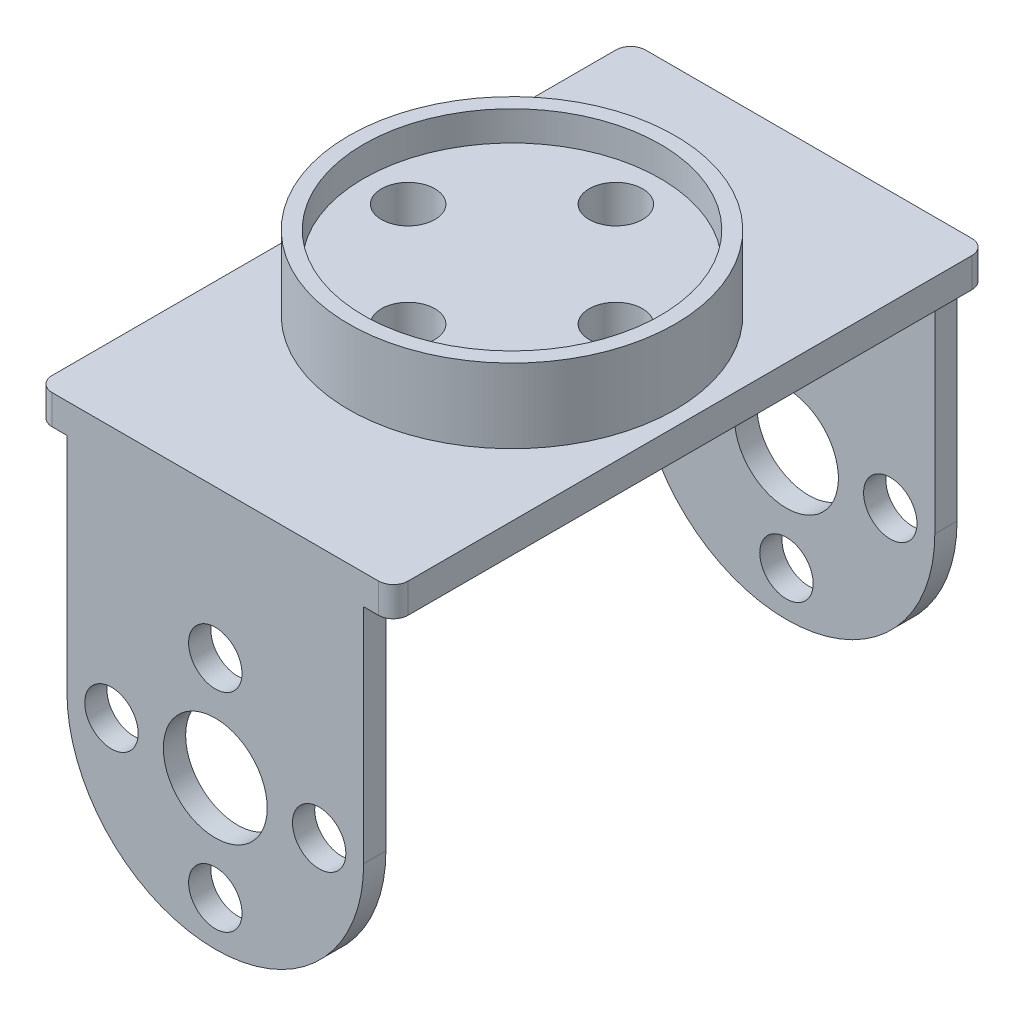
from build123d import *

# Parameters (mm, degrees)
SKETCH_1_W               = 24
SKETCH_1_H               = 30
EXTRUDE_1_DEPTH          = 40
CUT_EXTRUDE_1_DEPTH      = 56.461698495
CUT_EXTRUDE_2_DEPTH      = 18.5
CUT_EXTRUDE_2_DEPTH_BACK = 18.5
CUT_EXTRUDE_3_REACH      = 57.462
SKETCH_4_R               = 1.8
SKETCH_4_R_2             = 3.5
SKETCH_5_R               = 11
EXTRUDE_2_DEPTH          = 5
SKETCH_6_R               = 10
CUT_EXTRUDE_4_DEPTH      = 2
SKETCH_7_R               = 1.8
CUT_EXTRUDE_5_DEPTH      = 56.461698495
SKETCH_8_R               = 2.7
CUT_EXTRUDE_6_DEPTH      = 2
FILLET_1_R               = 1


with BuildPart() as part:
    # 草图1 → 凸台-拉伸1 (new body)
    with BuildSketch(Plane.XY):
        with Locations((-12, 15)):
            Rectangle(SKETCH_1_W, SKETCH_1_H)
    extrude(amount=EXTRUDE_1_DEPTH)

    # 草图2 → 切除-拉伸1 (cut, through all)
    with BuildSketch(Plane(origin=(0, 0, 0), x_dir=(-1, 0, 0), z_dir=(0, 0, -1))):
        with BuildLine():
            Line((0, 0), (12, 0))
            Line((12, 0), (12, 3))
            ThreePointArc((12, 3), (4.928932188, 5.928932188), (2, 13))
            Line((2, 13), (2, 28))
            Line((2, 28), (0, 28))
            Line((0, 28), (0, 0))
        make_face()
        with BuildLine():
            Line((12, 3), (12, 0))
            Line((12, 0), (24, 0))
            Line((24, 0), (24, 28))
            Line((24, 28), (22, 28))
            Line((22, 28), (22, 13))
            ThreePointArc((22, 13), (19.071067812, 5.928932188), (12, 3))
        make_face()
    extrude(amount=-CUT_EXTRUDE_1_DEPTH, mode=Mode.SUBTRACT)

    # 草图3 → 切除-拉伸2 (cut, two sides: drawn at the far end of the back side and taken through both)
    with BuildSketch(Plane(origin=(0, 0, 20), x_dir=(-1, 0, 0), z_dir=(0, 0, -1)).offset(-CUT_EXTRUDE_2_DEPTH_BACK)):
        with BuildLine():
            Line((2, 28), (2, 13))
            ThreePointArc((2, 13), (12, 3), (22, 13))
            Line((22, 13), (22, 28))
            Line((22, 28), (2, 28))
        make_face()
    extrude(amount=CUT_EXTRUDE_2_DEPTH + CUT_EXTRUDE_2_DEPTH_BACK, mode=Mode.SUBTRACT)

    # 切除-拉伸3: up to this face of the body (flat: up to its plane)
    cut_extrude_3_end = Plane(part.part.faces().sort_by_distance((-12, 17.655371512, 40))[0])
    # 草图4 → 切除-拉伸3 (cut, up to the picked face)
    with BuildSketch(Plane(origin=(0, 0, 0), x_dir=(-1, 0, 0), z_dir=(0, 0, -1)), mode=Mode.PRIVATE) as cut_extrude_3_sk1:
        with Locations((12, 6)):
            Circle(SKETCH_4_R)
    cut_extrude_3_tool1 = split(extrude(cut_extrude_3_sk1.sketch, amount=-CUT_EXTRUDE_3_REACH, mode=Mode.PRIVATE), bisect_by=cut_extrude_3_end, keep=Keep.BOTH, mode=Mode.PRIVATE)
    # 草图4 → 切除-拉伸3 (cut, up to the picked face)
    with BuildSketch(Plane(origin=(0, 0, 0), x_dir=(-1, 0, 0), z_dir=(0, 0, -1)), mode=Mode.PRIVATE) as cut_extrude_3_sk2:
        with Locations((12, 13)):
            Circle(SKETCH_4_R_2)
    cut_extrude_3_tool2 = split(extrude(cut_extrude_3_sk2.sketch, amount=-CUT_EXTRUDE_3_REACH, mode=Mode.PRIVATE), bisect_by=cut_extrude_3_end, keep=Keep.BOTH, mode=Mode.PRIVATE)
    # 草图4 → 切除-拉伸3 (cut, up to the picked face)
    with BuildSketch(Plane(origin=(0, 0, 0), x_dir=(-1, 0, 0), z_dir=(0, 0, -1)), mode=Mode.PRIVATE) as cut_extrude_3_sk3:
        with Locations((12, 20)):
            Circle(SKETCH_4_R)
    cut_extrude_3_tool3 = split(extrude(cut_extrude_3_sk3.sketch, amount=-CUT_EXTRUDE_3_REACH, mode=Mode.PRIVATE), bisect_by=cut_extrude_3_end, keep=Keep.BOTH, mode=Mode.PRIVATE)
    # 草图4 → 切除-拉伸3 (cut, up to the picked face)
    with BuildSketch(Plane(origin=(0, 0, 0), x_dir=(-1, 0, 0), z_dir=(0, 0, -1)), mode=Mode.PRIVATE) as cut_extrude_3_sk4:
        with Locations((19, 13)):
            Circle(SKETCH_4_R)
    cut_extrude_3_tool4 = split(extrude(cut_extrude_3_sk4.sketch, amount=-CUT_EXTRUDE_3_REACH, mode=Mode.PRIVATE), bisect_by=cut_extrude_3_end, keep=Keep.BOTH, mode=Mode.PRIVATE)
    # 草图4 → 切除-拉伸3 (cut, up to the picked face)
    with BuildSketch(Plane(origin=(0, 0, 0), x_dir=(-1, 0, 0), z_dir=(0, 0, -1)), mode=Mode.PRIVATE) as cut_extrude_3_sk5:
        with Locations((5, 13)):
            Circle(SKETCH_4_R)
    cut_extrude_3_tool5 = split(extrude(cut_extrude_3_sk5.sketch, amount=-CUT_EXTRUDE_3_REACH, mode=Mode.PRIVATE), bisect_by=cut_extrude_3_end, keep=Keep.BOTH, mode=Mode.PRIVATE)
    add(cut_extrude_3_tool1.solids().sort_by(Axis((-12, 6, 0), (0, 0, 1)))[0], mode=Mode.SUBTRACT)
    add(cut_extrude_3_tool2.solids().sort_by(Axis((-12, 13, 0), (0, 0, 1)))[0], mode=Mode.SUBTRACT)
    add(cut_extrude_3_tool3.solids().sort_by(Axis((-12, 20, 0), (0, 0, 1)))[0], mode=Mode.SUBTRACT)
    add(cut_extrude_3_tool4.solids().sort_by(Axis((-19, 13, 0), (0, 0, 1)))[0], mode=Mode.SUBTRACT)
    add(cut_extrude_3_tool5.solids().sort_by(Axis((-5, 13, 0), (0, 0, 1)))[0], mode=Mode.SUBTRACT)


with BuildPart() as body_2:
    # 草图5 → 凸台-拉伸2 (new body)
    with BuildSketch(Plane(origin=(0, 30, 0), x_dir=(1, 0, 0), z_dir=(0, 1, 0))):
        with Locations(Location((-12, -20, 0), (0, 0, 180))):
            Circle(SKETCH_5_R)
    extrude(amount=EXTRUDE_2_DEPTH)

    # 草图6 → 切除-拉伸4 (cut)
    with BuildSketch(Plane(origin=(0, 35, 0), x_dir=(1, 0, 0), z_dir=(0, 1, 0))):
        with Locations(Location((-12, -20, 0), (0, 0, 180))):
            Circle(SKETCH_6_R)
    extrude(amount=-CUT_EXTRUDE_4_DEPTH, mode=Mode.SUBTRACT)


with BuildPart() as cut_extrude_5_tool:
    # 草图7 → 切除-拉伸5 (new, through all)
    with BuildSketch(Plane(origin=(0, 33, 0), x_dir=(1, 0, 0), z_dir=(0, 1, 0))):
        with Locations(Location((-12, -13, 0), (0, 0, 180))):
            Circle(SKETCH_7_R)
        with Locations(Location((-5, -20, 0), (0, 0, 180))):
            Circle(SKETCH_7_R)
        with Locations(Location((-12, -27, 0), (0, 0, 180))):
            Circle(SKETCH_7_R)
        with Locations(Location((-19, -20, 0), (0, 0, 180))):
            Circle(SKETCH_7_R)
    extrude(amount=-CUT_EXTRUDE_5_DEPTH)


with BuildPart() as part_1:
    add(part.part)

    # 切除-拉伸5: cut by cut_extrude_5_tool
    add(cut_extrude_5_tool.part, mode=Mode.SUBTRACT)

    # 草图8 → 切除-拉伸6 (cut)
    with BuildSketch(Plane.XZ.offset(-28)):
        with Locations(Location((-12, 27, 0), (0, 0, 270))):
            Circle(SKETCH_8_R)
        with Locations(Location((-5, 20, 0), (0, 0, 270))):
            Circle(SKETCH_8_R)
        with Locations(Location((-19, 20, 0), (0, 0, 270))):
            Circle(SKETCH_8_R)
        with Locations(Location((-12, 13, 0), (0, 0, 270))):
            Circle(SKETCH_8_R)
    extrude(amount=-CUT_EXTRUDE_6_DEPTH, mode=Mode.SUBTRACT)

    # 圆角1
    fillet_1_edges = [part_1.edges().sort_by_distance(p)[0] for p in [
        (-24, 29, 40),
        (0, 29, 0),
        (0, 29, 40),
        (-24, 29, 0),
    ]]
    fillet(fillet_1_edges, radius=FILLET_1_R)


with BuildPart() as body_2_1:
    add(body_2.part)

    # 切除-拉伸5: cut by cut_extrude_5_tool
    add(cut_extrude_5_tool.part, mode=Mode.SUBTRACT)


solid = Compound([part_1.part, body_2_1.part])
